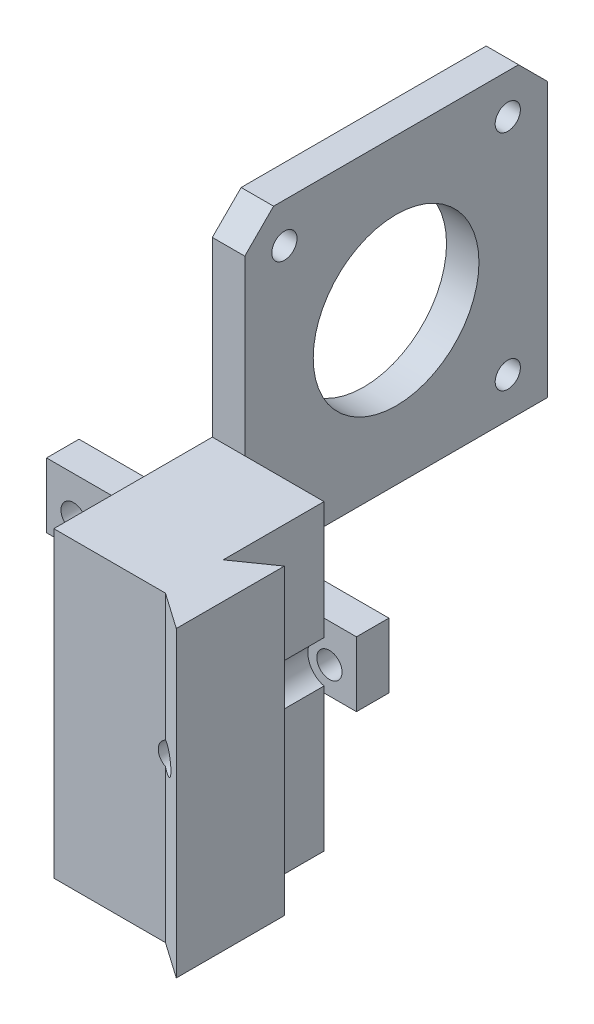
from build123d import *

# Parameters (mm, degrees)
SKETCH_1_W            = 43
SKETCH_1_H            = 9
SKETCH_1_R            = 1.75
EXTRUDE_1_DEPTH       = 4.5
SKETCH_2_W            = 4.5
SKETCH_2_H            = 42
EXTRUDE_2_DEPTH       = 42
SKETCH_3_R            = 11.5
SKETCH_3_R_2          = 1.75
CUT_EXTRUDE_2_DEPTH   = 4.5
EXTRUDE_10_DEPTH      = 14
EXTRUDE_10_DEPTH_BACK = 28
SKETCH_11_W           = 5.5
SKETCH_11_H           = 22
SKETCH_1_6_R          = 1.75
CUT_EXTRUDE_7_DEPTH   = 64.659249132
CUT_EXTRUDE_START     = -4.5
SKETCH_12_R           = 3
CUT_EXTRUDE_8_DEPTH   = 14


with BuildPart() as part:
    # 草图1 → 凸台-拉伸1 (new body)
    with BuildSketch(Plane.XY):
        Rectangle(SKETCH_1_W, SKETCH_1_H)
        with Locations((-17.75, -0.75)):
            Circle(SKETCH_1_R, mode=Mode.SUBTRACT)
        with Locations(Location((17.75, -0.75, 0), (0, 0, 180))):
            Circle(SKETCH_1_R, mode=Mode.SUBTRACT)
    extrude(amount=EXTRUDE_1_DEPTH)

    # 草图2 → 凸台-拉伸2 (add)
    with BuildSketch(Plane.XY.offset(4.5)):
        with Locations((3.75, 25.5)):
            Rectangle(SKETCH_2_W, SKETCH_2_H)
    extrude(amount=-EXTRUDE_2_DEPTH)

    # 草图3 → 切除-拉伸2 (cut)
    with BuildSketch(Plane(origin=(6, 0, 0), x_dir=(0, 0, -1), z_dir=(1, 0, 0))):
        with Locations((16.5, 25.5)):
            Circle(SKETCH_3_R)
        with Locations((32, 41)):
            Circle(SKETCH_3_R_2)
        with Locations(Location((32, 10, 0), (0, 0, 180))):
            Circle(SKETCH_3_R_2)
        with Locations((1, 10)):
            Circle(SKETCH_3_R_2)
        with Locations(Location((1, 41, 0), (0, 0, 180))):
            Circle(SKETCH_3_R_2)
        Polygon((33.5, 46.5), (37.5, 42.5), (37.5, 46.5), align=None)
        Polygon((-0.5, 46.5), (-4.5, 42.5), (-4.5, 46.5), align=None)
    extrude(amount=-CUT_EXTRUDE_2_DEPTH, mode=Mode.SUBTRACT)

    # 草图11 → 凸台-拉伸10 (add, two sides: drawn at the far end of the back side and taken through both)
    with BuildSketch(Plane(origin=(0, 4.5, 0), x_dir=(1, 0, 0), z_dir=(0, 1, 0)).offset(-EXTRUDE_10_DEPTH_BACK)):
        Polygon((22, -22.5), (22, -15), (17, -18.5), (17, -22.5), align=None)
        Polygon((17, -22.5), (17, -18.5), (17, -4.5), (7, -4.5), (7, -26.5), (17, -26.5), align=None)
        Polygon((22, -30), (22, -22.5), (17, -22.5), (17, -26.5), align=None)
        with Locations((4.25, -15.5)):
            Rectangle(SKETCH_11_W, SKETCH_11_H)
    extrude(amount=EXTRUDE_10_DEPTH + EXTRUDE_10_DEPTH_BACK)

    # 草图1<6> → 切除-拉伸7 (cut, through all)
    with BuildSketch(Plane.XY):
        with Locations(Location((17.75, -0.75, 0), (0, 0, 180))):
            Circle(SKETCH_1_6_R)
    extrude(amount=CUT_EXTRUDE_7_DEPTH, mode=Mode.SUBTRACT)

    # 草图12 → 切除-拉伸8 (cut)
    with BuildSketch(Plane(origin=(0, 0, 0), x_dir=(-1, 0, 0), z_dir=(0, 0, -1)).offset(CUT_EXTRUDE_START)):
        with Locations((-17.75, -0.75)):
            Circle(SKETCH_12_R)
    extrude(amount=-CUT_EXTRUDE_8_DEPTH, mode=Mode.SUBTRACT)


solid = part.part
